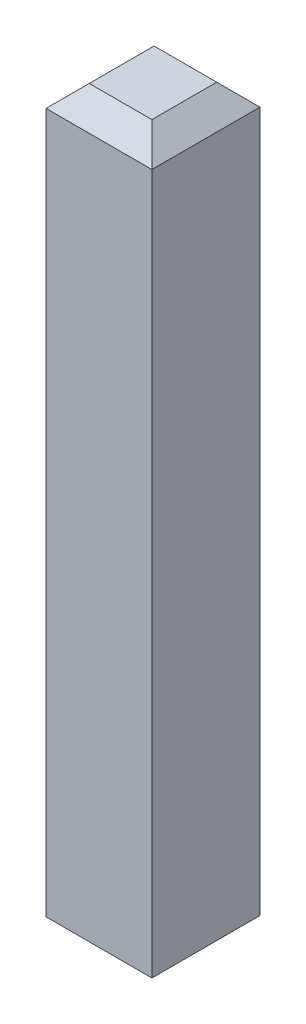
from build123d import *

# Parameters (mm, degrees)
SKETCH1_W           = 4.9
SKETCH1_H           = 5
BOSS_EXTRUDE1_DEPTH = 16.7
CHAMFER1_SIZE       = 1


with BuildPart() as part:
    # Sketch1 → Boss-Extrude1 (new, symmetric)
    with BuildSketch(Plane(origin=(0, 0, 0), x_dir=(1, 0, 0), z_dir=(0, 1, 0))):
        with Locations((2.45, 2.5)):
            Rectangle(SKETCH1_W, SKETCH1_H)
    extrude(amount=BOSS_EXTRUDE1_DEPTH, both=True)

    # Chamfer1
    chamfer1_edges = [part.edges().sort_by_distance(p)[0] for p in [
        (4.9, 16.7, -2.5),
        (2.45, 16.7, -5),
        (0, 16.7, -2.5),
        (2.45, 16.7, 0),
    ]]
    chamfer(chamfer1_edges, length=CHAMFER1_SIZE)


solid = part.part
